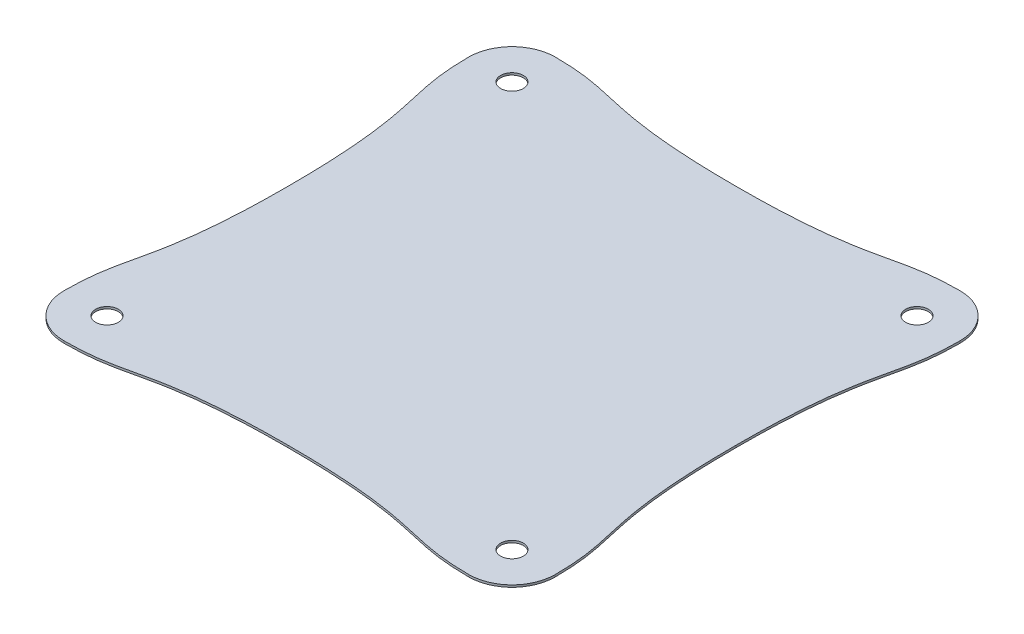
from build123d import *

# Parameters (mm, degrees)
SKETCH1_R           = 2.1
BOSS_EXTRUDE1_DEPTH = 0.4


with BuildPart() as part:
    # Sketch1 → Boss-Extrude1 (new body)
    with BuildSketch(Plane(origin=(0, 0, 0), x_dir=(1, 0, 0), z_dir=(0, 1, 0))):
        with BuildLine():
            ThreePointArc((0, 83), (-5.656854249, 80.656854249), (-8, 75))
            add(Edge.make_bspline(
                [(-8, 75), (-8, 62.5), (-4, 62.5), (-4, 37.5)],
                knots=[0, 0, 0, 0, 1, 1, 1, 1], degree=3))
            add(Edge.make_bspline(
                [(-8, 0), (-8, 12.5), (-4, 12.5), (-4, 37.5)],
                knots=[0, 0, 0, 0, 1, 1, 1, 1], degree=3))
            ThreePointArc((-8, 0), (-5.656854249, -5.656854249), (0, -8))
            add(Edge.make_bspline(
                [(0, -8), (12.5, -8), (12.5, -4), (37.5, -4)],
                knots=[0, 0, 0, 0, 1, 1, 1, 1], degree=3))
            add(Edge.make_bspline(
                [(75, -8), (62.5, -8), (62.5, -4), (37.5, -4)],
                knots=[0, 0, 0, 0, 1, 1, 1, 1], degree=3))
            ThreePointArc((75, -8), (80.656854249, -5.656854249), (83, 0))
            add(Edge.make_bspline(
                [(83, 0), (83, 12.5), (79, 12.5), (79, 37.5)],
                knots=[0, 0, 0, 0, 1, 1, 1, 1], degree=3))
            add(Edge.make_bspline(
                [(83, 75), (83, 62.5), (79, 62.5), (79, 37.5)],
                knots=[0, 0, 0, 0, 1, 1, 1, 1], degree=3))
            ThreePointArc((83, 75), (80.656854249, 80.656854249), (75, 83))
            add(Edge.make_bspline(
                [(75, 83), (62.5, 83), (62.5, 79), (37.5, 79)],
                knots=[0, 0, 0, 0, 1, 1, 1, 1], degree=3))
            add(Edge.make_bspline(
                [(0, 83), (12.5, 83), (12.5, 79), (37.5, 79)],
                knots=[0, 0, 0, 0, 1, 1, 1, 1], degree=3))
        make_face()
        with Locations(Location((0, 75, 0), (0, 0, 270))):
            Circle(SKETCH1_R, mode=Mode.SUBTRACT)
        with Locations(Location((75, 75, 0), (0, 0, 270))):
            Circle(SKETCH1_R, mode=Mode.SUBTRACT)
        with Locations(Location((75, 0, 0), (0, 0, 270))):
            Circle(SKETCH1_R, mode=Mode.SUBTRACT)
        with Locations(Location((0, 0, 0), (0, 0, 270))):
            Circle(SKETCH1_R, mode=Mode.SUBTRACT)
    extrude(amount=BOSS_EXTRUDE1_DEPTH)


solid = part.part
